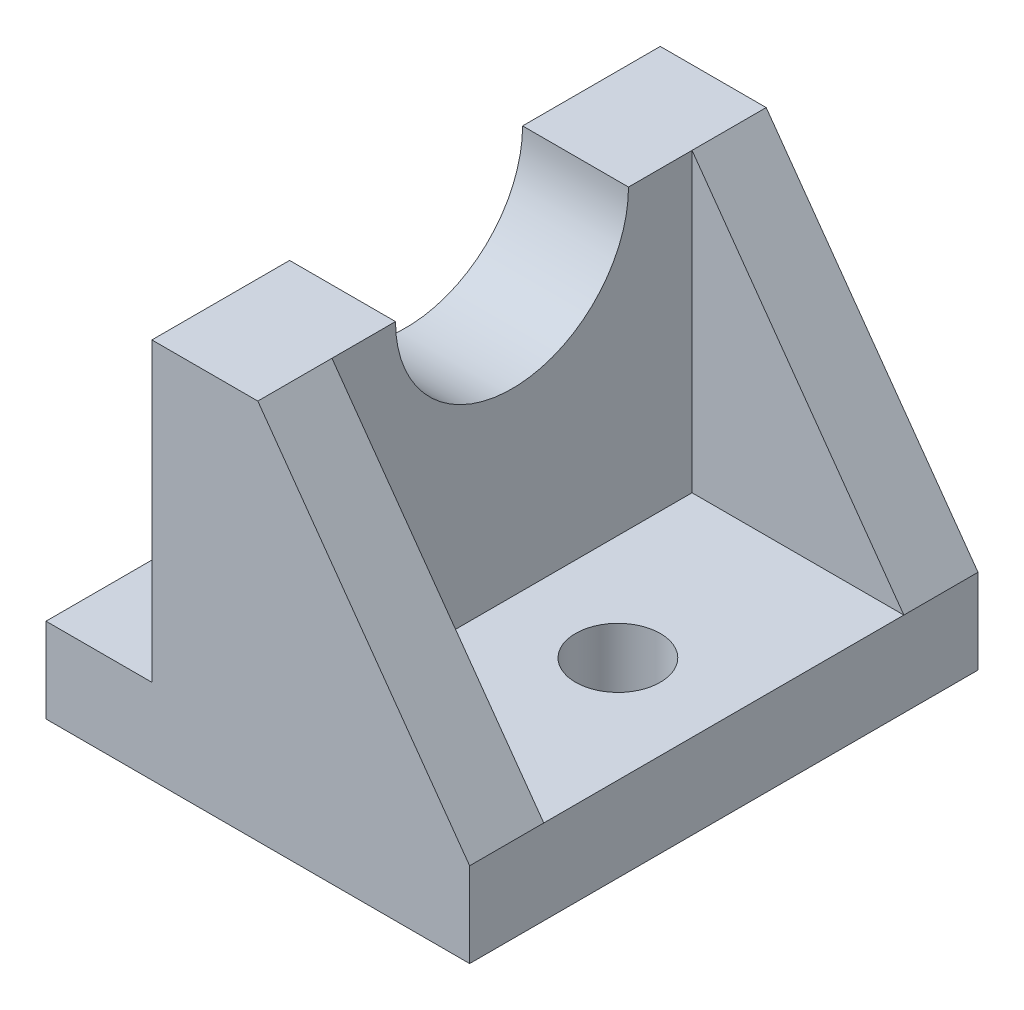
from build123d import *

# Parameters (mm, degrees)
EXTRUDE_1_DEPTH     = 60
SKETCH_2_W          = 50
SKETCH_2_H          = 85
CUT_EXTRUDE_1_DEPTH = 70
SKETCH_3_R          = 10
CUT_EXTRUDE_2_DEPTH = 105.880884817
SKETCH_4_R          = 27.5
CUT_EXTRUDE_3_DEPTH = 107.066017178


with BuildPart() as part:
    # Эскиз1 → Бобышка-Вытянуть1 (new, symmetric)
    with BuildSketch(Plane.XY):
        Polygon((50, -25), (0, 45), (-25, 45), (-25, -25), (-50, -25), (-50, -45), (50, -45), align=None)
    extrude(amount=EXTRUDE_1_DEPTH, both=True)

    # Эскиз2 → Вырез-Вытянуть1 (cut)
    with BuildSketch(Plane(origin=(0, 45, 0), x_dir=(1, 0, 0), z_dir=(0, 1, 0))):
        with Locations((25, 0)):
            Rectangle(SKETCH_2_W, SKETCH_2_H)
    extrude(amount=-CUT_EXTRUDE_1_DEPTH, mode=Mode.SUBTRACT)

    # Эскиз3 → Вырез-Вытянуть2 (cut, through all)
    with BuildSketch(Plane(origin=(0, -25, 0), x_dir=(1, 0, 0), z_dir=(0, 1, 0))):
        with Locations(Location((25, 0, 0), (0, 0, 180))):
            Circle(SKETCH_3_R)
    extrude(amount=-CUT_EXTRUDE_2_DEPTH, mode=Mode.SUBTRACT)

    # Эскиз4 → Вырез-Вытянуть3 (cut, through all)
    with BuildSketch(Plane.ZY.offset(25)):
        with Locations((0, 45)):
            Circle(SKETCH_4_R)
    extrude(amount=-CUT_EXTRUDE_3_DEPTH, mode=Mode.SUBTRACT)


solid = part.part
